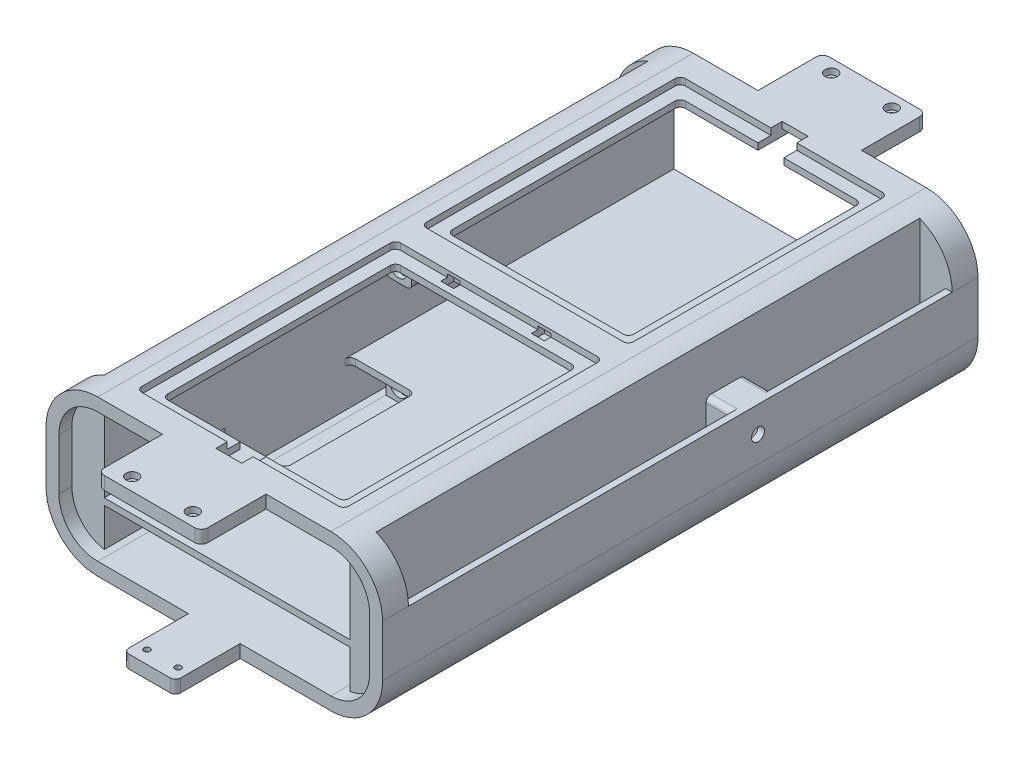
from build123d import *

# Parameters (mm, degrees)
BOSS_EXTRUDE1_DEPTH                                 = 146.05
SHELL1_T                                            = -6.35
LAYOUT_W                                            = 15.875
LAYOUT_H                                            = 279.4
LAYOUT_W_2                                          = 133.35
LAYOUT_W_3                                          = 31.75
LAYOUT_H_2                                          = 63.5
BOSS_EXTRUDE2_DEPTH                                 = 3.175
CUT_EXTRUDE1_DEPTH                                  = 185.259450233
CUT_EXTRUDE1_DEPTH_BACK                             = 185.259450233
SKETCH3_W                                           = 15.875
SKETCH3_H                                           = 266.7
BOSS_EXTRUDE3_REACH                                 = 177.288
BOSS_EXTRUDE3_DIRECTION_2_REACH                     = 177.288
BOSS_EXTRUDE4_START                                 = -279.4
BOSS_EXTRUDE4_DEPTH                                 = 279.4
SKETCH7_W                                           = 3.175
SKETCH7_H                                           = 25.4
BOSS_EXTRUDE5_DEPTH                                 = 279.4
SKETCH8_W                                           = 50.8
SKETCH8_H                                           = 31.75
BOSS_EXTRUDE6_DEPTH                                 = 6.35
FILLET1_R                                           = 3.175
CBORE_FOR_00_BINDING_HEAD_MACHINE_SCREW_D           = 3.000000096
CBORE_FOR_00_BINDING_HEAD_MACHINE_SCREW_CBORE_D     = 5.999999938
CBORE_FOR_00_BINDING_HEAD_MACHINE_SCREW_CBORE_DEPTH = 3.000000096
SKETCH13_W                                          = 25.4
SKETCH13_H                                          = 31.75
BOSS_EXTRUDE7_DEPTH                                 = 6.35
FILLET2_R                                           = 2.54
CBORE_FOR_00_BINDING_HEAD_MACHINE_S_2_D             = 3.000000096
CBORE_FOR_00_BINDING_HEAD_MACHINE_S_2_DEPTH         = 6.35
CBORE_FOR_00_BINDING_HEAD_MACHINE_S_2_CBORE_D       = 5.999999938
CBORE_FOR_00_BINDING_HEAD_MACHINE_S_2_CBORE_DEPTH   = 3.000000096
FILLET2_OF_MIRROR3_R                                = 2.54
FILLET1_OF_MIRROR6_R                                = 3.175
SKETCH16_W                                          = 101.6
SKETCH16_H                                          = 127
CUT_EXTRUDE2_DEPTH                                  = 3.175
CUT_EXTRUDE3_REACH                                  = 212.318
SKETCH17_W                                          = 88.9
SKETCH17_H                                          = 114.3
SKETCH29_W                                          = 6.35
SKETCH29_H                                          = 6.35
CUT_EXTRUDE11_DEPTH                                 = 4.7625
SKETCH21_W                                          = 12.7
SKETCH21_H                                          = 19.05
CUT_EXTRUDE7_DEPTH                                  = 3.175
CUT_EXTRUDE12_REACH                                 = 212.318
SKETCH31_W                                          = 12.7
SKETCH31_H                                          = 5.55625
SKETCH24_W                                          = 12.7
SKETCH24_H                                          = 4.7625
BOSS_EXTRUDE9_DEPTH                                 = 12.7
SKETCH26_W                                          = 12.7
SKETCH26_H                                          = 4.7625
BOSS_EXTRUDE10_DEPTH                                = 12.7
FILLET4_R                                           = 2.54
CBORE_FOR_M3_HEX_HEAD_MACHINE_SCREW1_D              = 3.4
CBORE_FOR_M3_HEX_HEAD_MACHINE_SCREW1_CBORE_D        = 8.4
CBORE_FOR_M3_HEX_HEAD_MACHINE_SCREW1_CBORE_DEPTH    = 2.3
SKETCH34_R                                          = 3.175
CUT_EXTRUDE15_DEPTH                                 = 234.68086277
SKETCH35_W                                          = 12.7
SKETCH35_H                                          = 3.175
BOSS_EXTRUDE11_DEPTH                                = 25.4
SKETCH36_W                                          = 12.7
SKETCH36_H                                          = 3.175
BOSS_EXTRUDE12_DEPTH                                = 12.7
FILLET5_R                                           = 2.54


with BuildPart() as part:
    # Sketch1 → Boss-Extrude1 (new, symmetric)
    with BuildSketch(Plane.XY):
        with BuildLine():
            Line((-82.55, 0), (-82.55, 25.4))
            ThreePointArc((-82.55, 25.4), (-75.110512242, 43.360512242), (-57.15, 50.8))
            Line((-57.15, 50.8), (57.15, 50.8))
            ThreePointArc((57.15, 50.8), (75.110512242, 43.360512242), (82.55, 25.4))
            Line((82.55, 25.4), (82.55, 0))
            ThreePointArc((82.55, 0), (75.110512242, -17.960512242), (57.15, -25.4))
            Line((57.15, -25.4), (-57.15, -25.4))
            ThreePointArc((-57.15, -25.4), (-75.110512242, -17.960512242), (-82.55, 0))
        make_face()
    extrude(amount=BOSS_EXTRUDE1_DEPTH, both=True)

    # Shell1
    shell1_openings = [part.faces().sort_by_distance(p)[0] for p in [
        (0, 12.7, -146.05),
        (0, 12.7, 146.05),
    ]]
    offset(amount=SHELL1_T, openings=shell1_openings, kind=Kind.INTERSECTION)

    # Layout → Boss-Extrude2 (add)
    # profile 1 of 3: a face of its own
    with BuildSketch(Plane(origin=(0, 0, 0), x_dir=(1, 0, 0), z_dir=(0, 1, 0))):
        with Locations((74.6125, 0)):
            Rectangle(LAYOUT_W, LAYOUT_H)
    # profile 2 of 3: a face of its own
    with BuildSketch(Plane(origin=(0, 0, 0), x_dir=(1, 0, 0), z_dir=(0, 1, 0))):
        Rectangle(LAYOUT_W_2, LAYOUT_H)
        with Locations((-44.45, -50.8)):
            Rectangle(LAYOUT_W_3, LAYOUT_H_2, mode=Mode.SUBTRACT)
    # profile 3 of 3: a face of its own
    with BuildSketch(Plane(origin=(0, 0, 0), x_dir=(1, 0, 0), z_dir=(0, 1, 0))):
        with Locations((-74.6125, 0)):
            Rectangle(LAYOUT_W, LAYOUT_H)
    extrude(amount=BOSS_EXTRUDE2_DEPTH)

    # Sketch3 → Cut-Extrude1 (cut, two sides: drawn at the far end of the back side and taken through both)
    with BuildSketch(Plane(origin=(0, 50.8, 0), x_dir=(1, 0, 0), z_dir=(0, 1, 0)).offset(-CUT_EXTRUDE1_DEPTH_BACK)):
        with Locations((-74.6125, 0)):
            Rectangle(SKETCH3_W, SKETCH3_H)
        with Locations((74.6125, 0)):
            Rectangle(SKETCH3_W, SKETCH3_H)
    extrude(amount=CUT_EXTRUDE1_DEPTH + CUT_EXTRUDE1_DEPTH_BACK, mode=Mode.SUBTRACT)

    # Sketch4 → Boss-Extrude3 (add, up to next)
    with BuildSketch(Plane(origin=(0, 0, 0), x_dir=(1, 0, 0), z_dir=(0, 1, 0)), mode=Mode.PRIVATE) as boss_extrude3_sk1:
        Polygon((66.675, -133.35), (66.675, 133.35), (82.55, 133.35), (82.55, 139.7), (60.325, 139.7), (60.325, -139.7), (76.2, -139.7), (76.2, -133.35), align=None)
    boss_extrude3_tool1 = extrude(boss_extrude3_sk1.sketch, amount=BOSS_EXTRUDE3_REACH, mode=Mode.PRIVATE) - part.part
    # Sketch4 → Boss-Extrude3 (add, up to next)
    with BuildSketch(Plane(origin=(0, 0, 0), x_dir=(1, 0, 0), z_dir=(0, 1, 0)), mode=Mode.PRIVATE) as boss_extrude3_sk2:
        Polygon((-76.2, -133.35), (-76.2, -139.7), (-60.325, -139.7), (-60.325, 139.7), (-82.55, 139.7), (-82.55, 133.35), (-66.675, 133.35), (-66.675, -133.35), align=None)
    boss_extrude3_tool2 = extrude(boss_extrude3_sk2.sketch, amount=BOSS_EXTRUDE3_REACH, mode=Mode.PRIVATE) - part.part
    add(boss_extrude3_tool1.solids().sort_by_distance((64.326823, 0, -2.844271))[0])
    add(boss_extrude3_tool2.solids().sort_by_distance((-64.326823, 0, -2.844271))[0])

    # Sketch4 → Boss-Extrude3 direction 2 (add, up to next)
    with BuildSketch(Plane(origin=(0, 0, 0), x_dir=(1, 0, 0), z_dir=(0, 1, 0)), mode=Mode.PRIVATE) as boss_extrude3_direction_2_sk1:
        Polygon((66.675, -133.35), (66.675, 133.35), (82.55, 133.35), (82.55, 139.7), (60.325, 139.7), (60.325, -139.7), (76.2, -139.7), (76.2, -133.35), align=None)
    boss_extrude3_direction_2_tool1 = extrude(boss_extrude3_direction_2_sk1.sketch, amount=-BOSS_EXTRUDE3_DIRECTION_2_REACH, mode=Mode.PRIVATE) - part.part
    # Sketch4 → Boss-Extrude3 direction 2 (add, up to next)
    with BuildSketch(Plane(origin=(0, 0, 0), x_dir=(1, 0, 0), z_dir=(0, 1, 0)), mode=Mode.PRIVATE) as boss_extrude3_direction_2_sk2:
        Polygon((-76.2, -133.35), (-76.2, -139.7), (-60.325, -139.7), (-60.325, 139.7), (-82.55, 139.7), (-82.55, 133.35), (-66.675, 133.35), (-66.675, -133.35), align=None)
    boss_extrude3_direction_2_tool2 = extrude(boss_extrude3_direction_2_sk2.sketch, amount=-BOSS_EXTRUDE3_DIRECTION_2_REACH, mode=Mode.PRIVATE) - part.part
    add(boss_extrude3_direction_2_tool1.solids().sort_by_distance((64.326823, 0, -2.844271))[0])
    add(boss_extrude3_direction_2_tool2.solids().sort_by_distance((-64.326823, 0, -2.844271))[0])

    # Sketch6 → Boss-Extrude4 (add)
    with BuildSketch(Plane(origin=(0, 0, -139.7), x_dir=(-1, 0, 0), z_dir=(0, 0, -1)).offset(BOSS_EXTRUDE4_START)):
        with BuildLine():
            Line((-60.325, 0), (-82.55, 0))
            ThreePointArc((-82.55, 0), (-76.2, -16.800520825), (-60.325, -25.200781238))
            Line((-60.325, -25.200781238), (-60.325, 0))
        make_face()
        with BuildLine():
            Line((82.55, 0), (60.325, 0))
            Line((60.325, 0), (60.325, -25.200781238))
            ThreePointArc((60.325, -25.200781238), (76.2, -16.800520825), (82.55, 0))
        make_face()
    extrude(amount=BOSS_EXTRUDE4_DEPTH)

    # Sketch7 → Boss-Extrude5 (add)
    with BuildSketch(Plane(origin=(0, 0, -139.7), x_dir=(-1, 0, 0), z_dir=(0, 0, -1))):
        with Locations((80.9625, 12.7)):
            Rectangle(SKETCH7_W, SKETCH7_H)
        with Locations((-80.9625, 12.7)):
            Rectangle(SKETCH7_W, SKETCH7_H)
    extrude(amount=-BOSS_EXTRUDE5_DEPTH)

    # Sketch8 → Boss-Extrude6 (add)
    with BuildSketch(Plane(origin=(0, 50.8, 0), x_dir=(1, 0, 0), z_dir=(0, 1, 0))):
        with Locations((0, 161.925)):
            Rectangle(SKETCH8_W, SKETCH8_H)
    boss_extrude6 = extrude(amount=-BOSS_EXTRUDE6_DEPTH)

    # Fillet1
    fillet1_edges = [part.edges().sort_by_distance(p)[0] for p in [
        (-25.4, 47.625, -177.8),
        (25.4, 47.625, -177.8),
    ]]
    fillet(fillet1_edges, radius=FILLET1_R)

    # CBORE for _00 Binding Head Machine Screw (through all)
    with Locations(Plane(origin=(0, 50.8, 0), x_dir=(-1, 0, 0), z_dir=(0, 1, 0))):
        with Locations((14.85, -171.45), (-14.85, -171.45)):
            cbore_for_00_binding_head_machine_screw = CounterBoreHole(CBORE_FOR_00_BINDING_HEAD_MACHINE_SCREW_D / 2, CBORE_FOR_00_BINDING_HEAD_MACHINE_SCREW_CBORE_D / 2, CBORE_FOR_00_BINDING_HEAD_MACHINE_SCREW_CBORE_DEPTH)

    # Sketch13 → Boss-Extrude7 (add)
    with BuildSketch(Plane.XZ.offset(25.4)):
        with Locations((0, -161.925)):
            Rectangle(SKETCH13_W, SKETCH13_H)
    boss_extrude7 = extrude(amount=-BOSS_EXTRUDE7_DEPTH)

    # Fillet2
    fillet2_edges = [part.edges().sort_by_distance(p)[0] for p in [
        (12.7, -22.225, -177.8),
        (-12.7, -22.225, -177.8),
    ]]
    fillet(fillet2_edges, radius=FILLET2_R)

    # CBORE for _00 Binding Head Machine S 2
    with Locations(Plane(origin=(0, -25.4, 0), x_dir=(-1, 0, 0), z_dir=(0, -1, 0))):
        with Locations((-7.6199916, 171.45), (7.6199916, 171.45)):
            cbore_for_00_binding_head_machine_s_2 = CounterBoreHole(CBORE_FOR_00_BINDING_HEAD_MACHINE_S_2_D / 2, CBORE_FOR_00_BINDING_HEAD_MACHINE_S_2_CBORE_D / 2, CBORE_FOR_00_BINDING_HEAD_MACHINE_S_2_CBORE_DEPTH, depth=CBORE_FOR_00_BINDING_HEAD_MACHINE_S_2_DEPTH)

    # Mirror3: Boss-Extrude7, CBORE for _00 Binding Head Machine S 2 across plane
    add(boss_extrude7.mirror(Plane.XY))
    add(cbore_for_00_binding_head_machine_s_2.mirror(Plane.XY), mode=Mode.SUBTRACT)

    # Fillet2 of Mirror3
    fillet2_of_mirror3_edges = [part.edges().sort_by_distance(p)[0] for p in [
        (12.7, -22.225, 177.8),
        (-12.7, -22.225, 177.8),
    ]]
    fillet(fillet2_of_mirror3_edges, radius=FILLET2_OF_MIRROR3_R)

    # Mirror6: Boss-Extrude6, CBORE for _00 Binding Head Machine Screw across plane
    add(boss_extrude6.mirror(Plane.XY))
    add(cbore_for_00_binding_head_machine_screw.mirror(Plane.XY), mode=Mode.SUBTRACT)

    # Fillet1 of Mirror6
    fillet1_of_mirror6_edges = [part.edges().sort_by_distance(p)[0] for p in [
        (-25.4, 47.625, 177.8),
        (25.4, 47.625, 177.8),
    ]]
    fillet(fillet1_of_mirror6_edges, radius=FILLET1_OF_MIRROR6_R)

    # Sketch16 → Cut-Extrude2 (cut)
    with BuildSketch(Plane(origin=(0, 50.8, 0), x_dir=(1, 0, 0), z_dir=(0, 1, 0))):
        with Locations((0, 69.85)):
            Rectangle(SKETCH16_W, SKETCH16_H)
        with Locations((0, -69.85)):
            Rectangle(SKETCH16_W, SKETCH16_H)
    extrude(amount=-CUT_EXTRUDE2_DEPTH, mode=Mode.SUBTRACT)

    # Sketch17 → Cut-Extrude3 (cut, up to next)
    with BuildSketch(Plane(origin=(0, 50.8, 0), x_dir=(1, 0, 0), z_dir=(0, 1, 0)), mode=Mode.PRIVATE) as cut_extrude3_sk1:
        with Locations((0, 69.85)):
            Rectangle(SKETCH17_W, SKETCH17_H)
    cut_extrude3_tool1 = extrude(cut_extrude3_sk1.sketch, amount=-CUT_EXTRUDE3_REACH, mode=Mode.PRIVATE) & part.part
    # Sketch17 → Cut-Extrude3 (cut, up to next)
    with BuildSketch(Plane(origin=(0, 50.8, 0), x_dir=(1, 0, 0), z_dir=(0, 1, 0)), mode=Mode.PRIVATE) as cut_extrude3_sk2:
        with Locations((0, -69.85)):
            Rectangle(SKETCH17_W, SKETCH17_H)
    cut_extrude3_tool2 = extrude(cut_extrude3_sk2.sketch, amount=-CUT_EXTRUDE3_REACH, mode=Mode.PRIVATE) & part.part
    add(cut_extrude3_tool1.solids().sort_by_distance((0, 50.8, -69.85))[0], mode=Mode.SUBTRACT)
    add(cut_extrude3_tool2.solids().sort_by_distance((0, 50.8, 69.85))[0], mode=Mode.SUBTRACT)

    # Sketch29 → Cut-Extrude11 (cut)
    with BuildSketch(Plane.XZ.offset(-44.45)):
        with Locations((-22.225, 6.35)):
            Rectangle(SKETCH29_W, SKETCH29_H)
        with Locations((22.225, 6.35)):
            Rectangle(SKETCH29_W, SKETCH29_H)
        with Locations((-22.225, -6.35)):
            Rectangle(SKETCH29_W, SKETCH29_H)
        with Locations((22.225, -6.35)):
            Rectangle(SKETCH29_W, SKETCH29_H)
    extrude(amount=-CUT_EXTRUDE11_DEPTH, mode=Mode.SUBTRACT)

    # Sketch21 → Cut-Extrude7 (cut)
    with BuildSketch(Plane(origin=(0, 44.45, 0), x_dir=(1, 0, 0), z_dir=(0, 1, 0))):
        with Locations((0, 136.525)):
            Rectangle(SKETCH21_W, SKETCH21_H)
    cut_extrude7 = extrude(amount=CUT_EXTRUDE7_DEPTH, mode=Mode.SUBTRACT)

    # Sketch31 → Cut-Extrude12 (cut, up to next)
    with BuildSketch(Plane(origin=(0, 50.8, 0), x_dir=(1, 0, 0), z_dir=(0, 1, 0)), mode=Mode.PRIVATE) as cut_extrude12_sk1:
        with Locations((0, 136.128125)):
            Rectangle(SKETCH31_W, SKETCH31_H)
    cut_extrude12_tool1 = extrude(cut_extrude12_sk1.sketch, amount=-CUT_EXTRUDE12_REACH, mode=Mode.PRIVATE) & part.part
    cut_extrude12 = cut_extrude12_tool1.solids().sort_by_distance((0, 50.8, -136.128125))[0]
    add(cut_extrude12, mode=Mode.SUBTRACT)

    # Mirror7: Cut-Extrude7, Cut-Extrude12 across plane
    add(cut_extrude7.mirror(Plane.XY), mode=Mode.SUBTRACT)
    add(cut_extrude12.mirror(Plane.XY), mode=Mode.SUBTRACT)

    # Sketch24 → Boss-Extrude9 (add)
    with BuildSketch(Plane(origin=(0, -19.05, 0), x_dir=(1, 0, 0), z_dir=(0, 1, 0))):
        with Locations((-50.8, 2.38125)):
            Rectangle(SKETCH24_W, SKETCH24_H)
        with Locations((50.8, 2.38125)):
            Rectangle(SKETCH24_W, SKETCH24_H)
    boss_extrude9 = extrude(amount=BOSS_EXTRUDE9_DEPTH)

    # Sketch26 → Boss-Extrude10 (add)
    with BuildSketch(Plane.XZ.offset(-44.45)):
        with Locations((50.8, -2.38125)):
            Rectangle(SKETCH26_W, SKETCH26_H)
        with Locations((-50.8, -2.38125)):
            Rectangle(SKETCH26_W, SKETCH26_H)
    boss_extrude10 = extrude(amount=BOSS_EXTRUDE10_DEPTH)

    # Mirror9: Boss-Extrude9, Boss-Extrude10 across plane
    add(boss_extrude9.mirror(Plane.XY))
    add(boss_extrude10.mirror(Plane.XY))

    # Fillet4
    fillet4_edges = [part.edges().sort_by_distance(p)[0] for p in [
        (-50.8, 49.2125, -6.35),
        (-50.8, 49.2125, -133.35),
        (50.8, 49.2125, -133.35),
        (50.8, 49.2125, -6.35),
        (-50.8, 49.2125, 6.35),
        (50.8, 49.2125, 6.35),
        (50.8, 49.2125, 133.35),
        (-50.8, 49.2125, 133.35),
        (44.45, 46.0375, -12.7),
        (44.45, 46.0375, -127),
        (-44.45, 46.0375, -127),
        (-44.45, 46.0375, -12.7),
        (-28.575, 1.5875, 19.05),
        (-44.45, 46.0375, 127),
        (44.45, 46.0375, 127),
        (44.45, 46.0375, 12.7),
        (-44.45, 46.0375, 12.7),
        (-28.575, 1.5875, 82.55),
        (-60.325, 1.5875, 82.55),
        (-60.325, 1.5875, 19.05),
        (-57.15, -6.35, 0),
        (-44.45, -6.35, 0),
        (44.45, -6.35, 0),
        (57.15, -6.35, 0),
        (-57.15, 31.75, 0),
        (-44.45, 31.75, 0),
        (57.15, 31.75, 0),
        (44.45, 31.75, 0),
    ]]
    fillet(fillet4_edges, radius=FILLET4_R)

    # CBORE for M3 Hex Head Machine Screw1 (through all)
    with Locations(Plane.XY.offset(4.7625)):
        with Locations((-50.8, 38.1), (50.8, 38.1), (50.8, -12.7), (-50.8, -12.7)):
            CounterBoreHole(CBORE_FOR_M3_HEX_HEAD_MACHINE_SCREW1_D / 2, CBORE_FOR_M3_HEX_HEAD_MACHINE_SCREW1_CBORE_D / 2, CBORE_FOR_M3_HEX_HEAD_MACHINE_SCREW1_CBORE_DEPTH)

    # Sketch34 → Cut-Extrude15 (cut, through all)
    with BuildSketch(Plane.ZY.offset(-60.325)):
        with Locations((-38.1, 12.7)):
            Circle(SKETCH34_R)
    extrude(amount=-CUT_EXTRUDE15_DEPTH, mode=Mode.SUBTRACT)

    # Sketch35 → Boss-Extrude11 (add)
    with BuildSketch(Plane(origin=(0, 0, 0), x_dir=(1, 0, 0), z_dir=(0, 1, 0))):
        with Locations((73.025, 46.0375)):
            Rectangle(SKETCH35_W, SKETCH35_H)
        with Locations((73.025, 30.1625)):
            Rectangle(SKETCH35_W, SKETCH35_H)
    extrude(amount=BOSS_EXTRUDE11_DEPTH)

    # Sketch36 → Boss-Extrude12 (add)
    with BuildSketch(Plane.XY.offset(-44.45)):
        with Locations((73.025, 23.8125)):
            Rectangle(SKETCH36_W, SKETCH36_H)
    extrude(amount=BOSS_EXTRUDE12_DEPTH)

    # Fillet5
    fillet5_edges = [part.edges().sort_by_distance(p)[0] for p in [
        (73.025, 25.4, -47.625),
        (73.025, 25.4, -28.575),
    ]]
    fillet(fillet5_edges, radius=FILLET5_R)


solid = part.part
